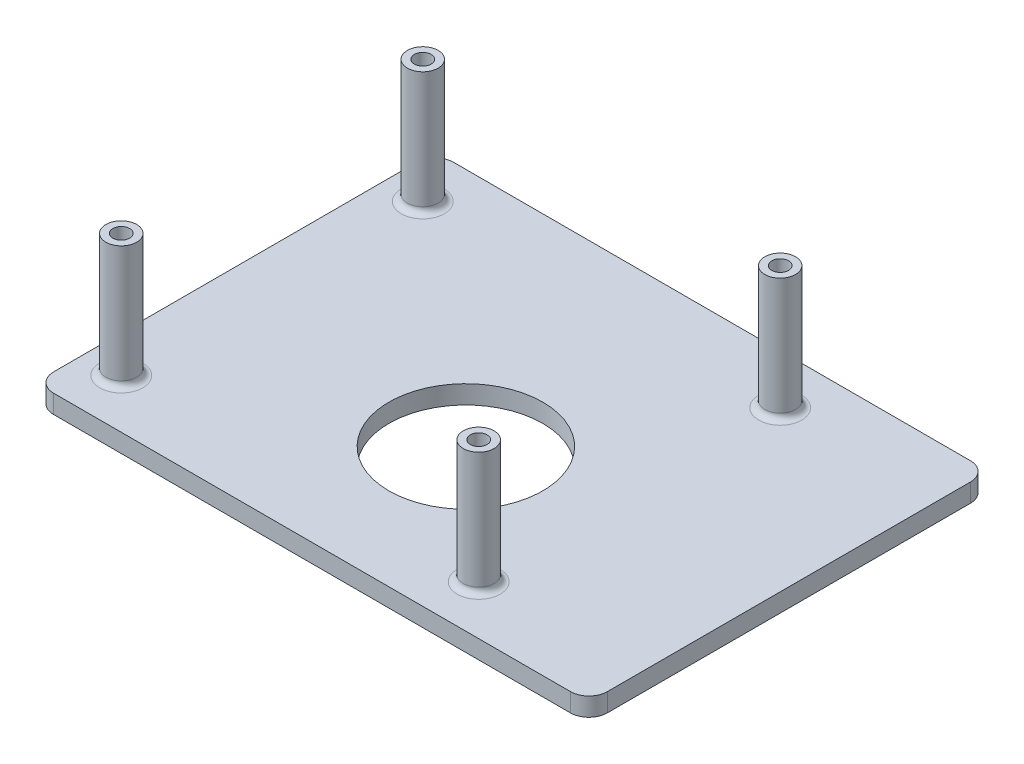
from build123d import *

# Parameters (mm, degrees)
SKIZZE1_W                       = 90
SKIZZE1_H                       = 65
AUFSATZ_LINEAR_AUSTRAGEN1_DEPTH = 3
SKIZZE3_R                       = 2.5
AUFSATZ_LINEAR_AUSTRAGEN2_DEPTH = 20
SKIZZE4_R                       = 1.364499713
SCHNITT_LINEAR_AUSTRAGEN2_DEPTH = 61.085355953
VERRUNDUNG1_R                   = 3
VERRUNDUNG2_R                   = 1
SKIZZE5_R                       = 12.500347999
SCHNITT_LINEAR_AUSTRAGEN3_DEPTH = 61.085355953


with BuildPart() as part:
    # Skizze1 → Aufsatz-Linear austragen1 (new body)
    with BuildSketch(Plane(origin=(0, 0, 0), x_dir=(1, 0, 0), z_dir=(0, 1, 0))):
        Rectangle(SKIZZE1_W, SKIZZE1_H)
    extrude(amount=AUFSATZ_LINEAR_AUSTRAGEN1_DEPTH)

    # Skizze3 → Aufsatz-Linear austragen2 (add)
    with BuildSketch(Plane(origin=(0, 3, 0), x_dir=(1, 0, 0), z_dir=(0, 1, 0))):
        with Locations(Location((-39, 24.5, 0), (0, 0, 270))):
            Circle(SKIZZE3_R)
        with Locations(Location((19.085512482, 24.5, 0), (0, 0, 270))):
            Circle(SKIZZE3_R)
        with Locations(Location((19.085512482, -24.5, 0), (0, 0, 270))):
            Circle(SKIZZE3_R)
        with Locations(Location((-39, -24.5, 0), (0, 0, 270))):
            Circle(SKIZZE3_R)
    extrude(amount=AUFSATZ_LINEAR_AUSTRAGEN2_DEPTH)

    # Skizze4 → Schnitt-Linear austragen2 (cut, through all)
    with BuildSketch(Plane(origin=(0, 23, 0), x_dir=(1, 0, 0), z_dir=(0, 1, 0))):
        with Locations(Location((19.085512482, 24.5, 0), (0, 0, 270))):
            Circle(SKIZZE4_R)
        with Locations(Location((-39, 24.5, 0), (0, 0, 270))):
            Circle(SKIZZE4_R)
        with Locations(Location((-39, -24.5, 0), (0, 0, 270))):
            Circle(SKIZZE4_R)
        with Locations(Location((19.085512482, -24.5, 0), (0, 0, 270))):
            Circle(SKIZZE4_R)
    extrude(amount=-SCHNITT_LINEAR_AUSTRAGEN2_DEPTH, mode=Mode.SUBTRACT)

    # Verrundung1
    verrundung1_edges = [part.edges().sort_by_distance(p)[0] for p in [
        (-45, 1.5, 32.5),
        (-45, 1.5, -32.5),
        (45, 1.5, -32.5),
        (45, 1.5, 32.5),
    ]]
    fillet(verrundung1_edges, radius=VERRUNDUNG1_R)

    # Verrundung2
    verrundung2_edges = [part.edges().sort_by_distance(p)[0] for p in [
        (-39, 3, -27),
        (19.085512482, 3, -27),
        (19.085512482, 3, 22),
        (-39, 3, 22),
    ]]
    fillet(verrundung2_edges, radius=VERRUNDUNG2_R)

    # Skizze5 → Schnitt-Linear austragen3 (cut, through all)
    with BuildSketch(Plane.XZ):
        with Locations(Location((-1, 6.5, 0), (0, 0, 270))):
            Circle(SKIZZE5_R)
    extrude(amount=-SCHNITT_LINEAR_AUSTRAGEN3_DEPTH, mode=Mode.SUBTRACT)


solid = part.part
